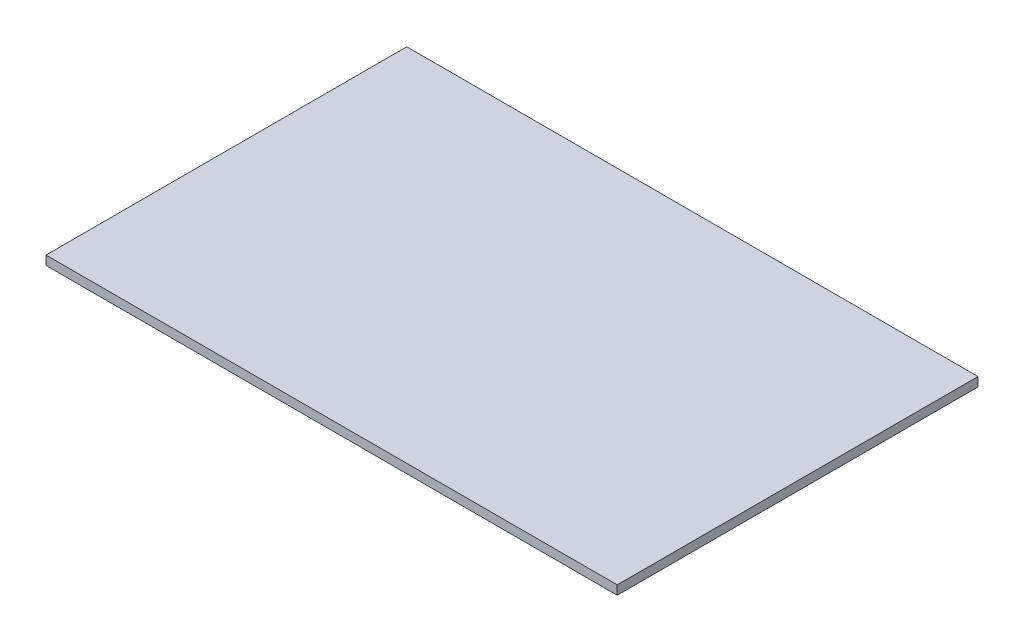
from build123d import *

# Parameters (mm, degrees)
SKETCH1_W           = 190
SKETCH1_H           = 120
BOSS_EXTRUDE1_DEPTH = 3


with BuildPart() as part:
    # Sketch1 → Boss-Extrude1 (new body)
    with BuildSketch(Plane(origin=(0, 0, 0), x_dir=(1, 0, 0), z_dir=(0, 1, 0))):
        with Locations((95, 0)):
            Rectangle(SKETCH1_W, SKETCH1_H)
    extrude(amount=BOSS_EXTRUDE1_DEPTH)


solid = part.part
